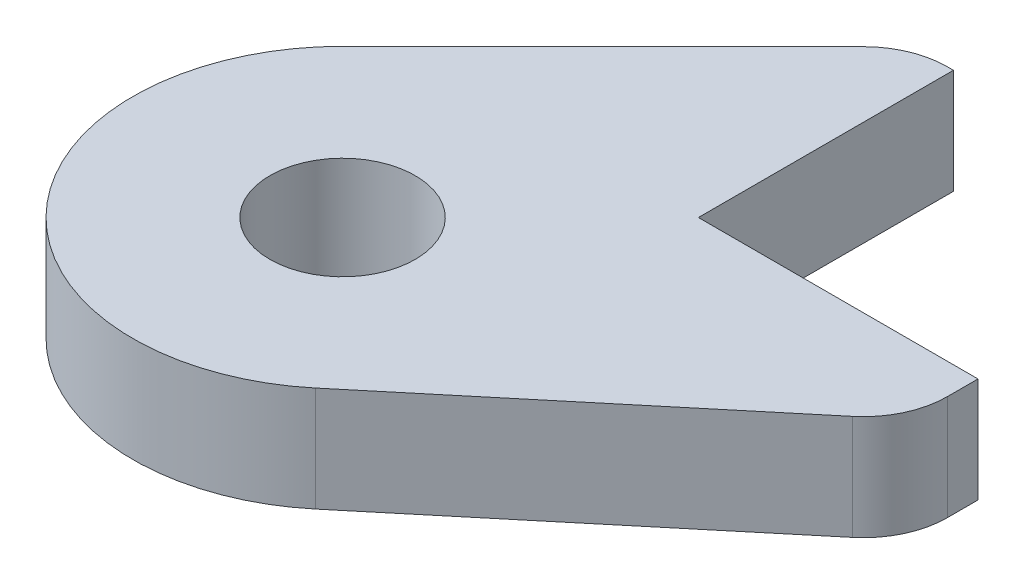
from build123d import *

# Parameters (mm, degrees)
BOSS_EXTRUDE2_DEPTH  = 4.7625
FILLET3_R            = 3.81
M6_CLEARANCE_HOLE3_D = 6.6


with BuildPart() as part:
    # Sketch4 → Boss-Extrude2 (new body)
    with BuildSketch(Plane(origin=(0, 0, 0), x_dir=(1, 0, 0), z_dir=(0, 1, 0))):
        with BuildLine():
            Line((-12.7, -1.115923164), (-12.7, -12.7))
            Line((-12.7, -12.7), (0, -12.7))
            Line((0, -12.7), (0, -15.875))
            Line((0, -15.875), (-14.688158885, -28.102607278))
            ThreePointArc((-14.688158885, -28.102607278), (-27.8212706, -27.199203284), (-27.509131561, -14.038757574))
            Line((-27.509131561, -14.038757574), (-14.554461437, -1.115923164))
            Line((-14.554461437, -1.115923164), (-12.7, -1.115923164))
        make_face()
    extrude(amount=BOSS_EXTRUDE2_DEPTH)

    # Fillet3
    fillet3_edges = [part.edges().sort_by_distance(p)[0] for p in [
        (0, 2.38125, 15.875),
        (-14.554461437, 2.38125, 1.115923164),
    ]]
    fillet(fillet3_edges, radius=FILLET3_R)

    # M6 Clearance Hole3 (through all)
    with Locations(Plane(origin=(0, 4.7625, 0), x_dir=(1, 0, 0), z_dir=(0, 1, 0))):
        with Locations((-20.782230509, -20.782230509)):
            Hole(M6_CLEARANCE_HOLE3_D / 2)


solid = part.part
